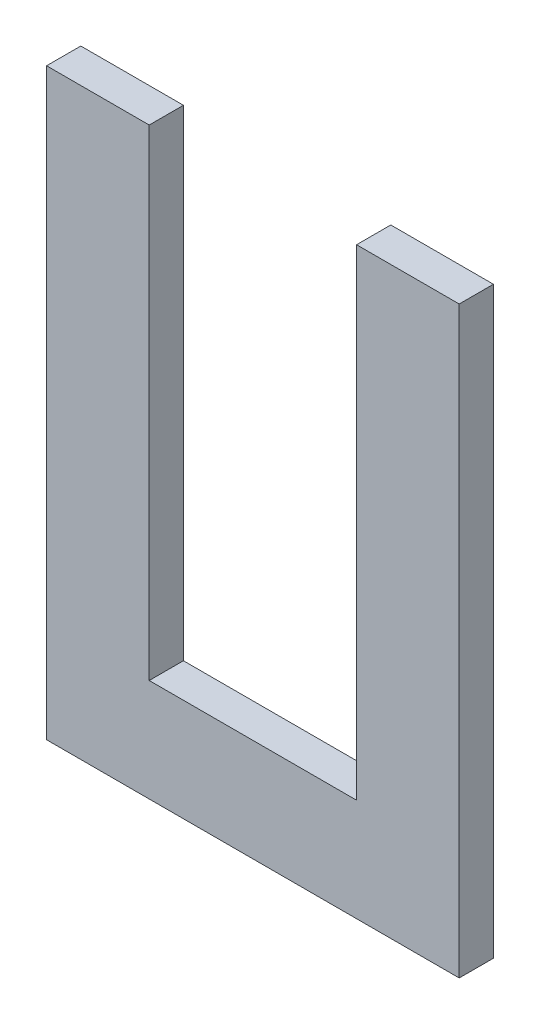
from build123d import *

# Parameters (mm, degrees)
SALIENTE_EXTRUIR1_DEPTH = 5


with BuildPart() as part:
    # Croquis1 → Saliente-Extruir1 (new body)
    with BuildSketch(Plane.XY):
        Polygon((-162.491930249, -715.732729732), (-177.491930249, -715.732729732), (-177.491930249, -801.032729732), (-117.191930249, -801.032729732), (-117.191930249, -715.732729732), (-132.191930249, -715.732729732), (-132.191930249, -786.032729732), (-162.491930249, -786.032729732), align=None)
    extrude(amount=SALIENTE_EXTRUIR1_DEPTH)


solid = part.part
